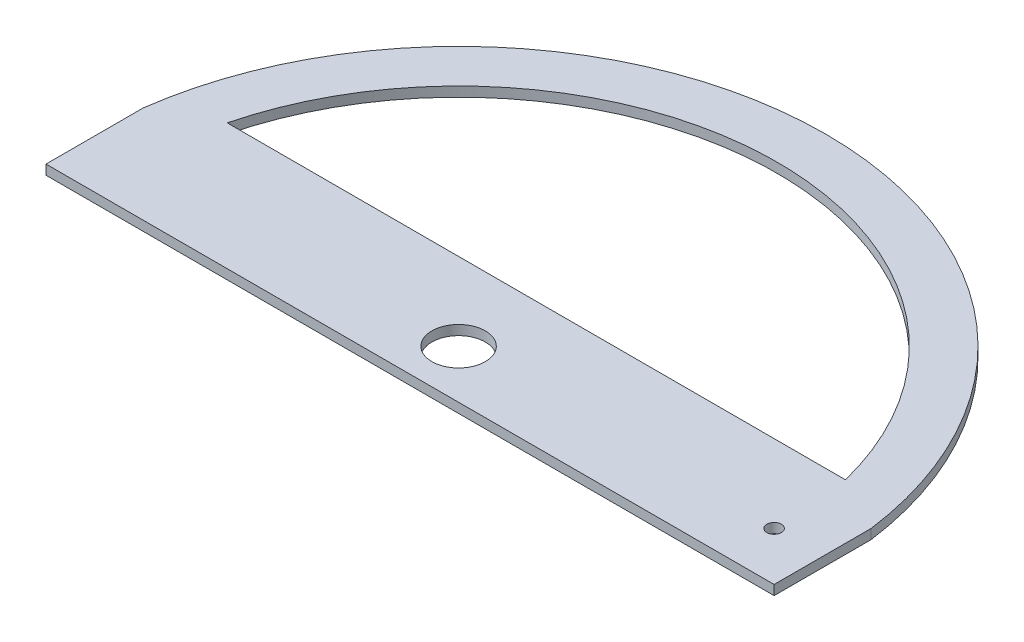
from build123d import *

# Parameters (mm, degrees)
BOSS_EXTRUDE1_DEPTH = 2
SKETCH2_R           = 5.5
SKETCH2_R_2         = 1.5
CUT_EXTRUDE1_DEPTH  = 2


with BuildPart() as part:
    # Sketch1 → Boss-Extrude1 (new body)
    with BuildSketch(Plane(origin=(0, 0, 0), x_dir=(1, 0, 0), z_dir=(0, 1, 0))):
        with BuildLine():
            Line((75, -10), (-75, -10))
            Line((-75, -10), (-75, 10))
            ThreePointArc((-75, 10), (0, 75.663729752), (75, 10))
            Line((75, 10), (75, -10))
        make_face()
        with BuildLine():
            Line((-63.679706635, 16.019374764), (63.679706635, 16.019374764))
            ThreePointArc((63.679706635, 16.019374764), (0, 65.663729752), (-63.679706635, 16.019374764))
        make_face(mode=Mode.SUBTRACT)
    extrude(amount=BOSS_EXTRUDE1_DEPTH)

    # Sketch2 → Cut-Extrude1 (cut)
    with BuildSketch(Plane(origin=(0, 2, 0), x_dir=(1, 0, 0), z_dir=(0, 1, 0))):
        with Locations(Location((0, 0, 0), (0, 0, 270))):
            Circle(SKETCH2_R)
        with Locations(Location((65, 0, 0), (0, 0, 270))):
            Circle(SKETCH2_R_2)
    extrude(amount=-CUT_EXTRUDE1_DEPTH, mode=Mode.SUBTRACT)


solid = part.part
